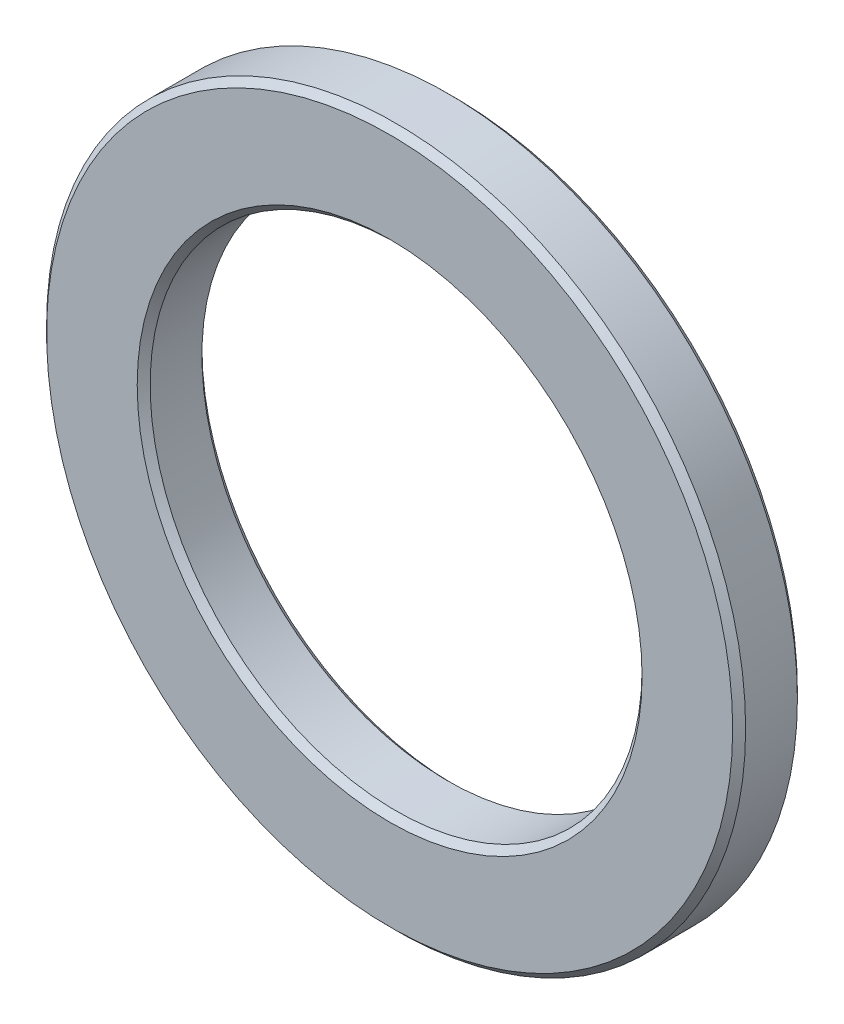
from build123d import *

# Parameters (mm, degrees)
SKIZZE1_R                       = 27
SKIZZE1_R_2                     = 19
AUFSATZ_LINEAR_AUSTRAGEN1_DEPTH = 2.5
FASE1_SIZE                      = 0.5


with BuildPart() as part:
    # Skizze1 → Aufsatz-Linear austragen1 (new, symmetric)
    with BuildSketch(Plane.XY):
        Circle(SKIZZE1_R)
        Circle(SKIZZE1_R_2, mode=Mode.SUBTRACT)
    extrude(amount=AUFSATZ_LINEAR_AUSTRAGEN1_DEPTH, both=True)

    # Fase1
    fase1_edges = [part.edges().sort_by_distance(p)[0] for p in [
        (-19, 0, -2.5),
        (-27, 0, -2.5),
        (-27, 0, 2.5),
        (-19, 0, 2.5),
    ]]
    chamfer(fase1_edges, length=FASE1_SIZE)


solid = part.part
